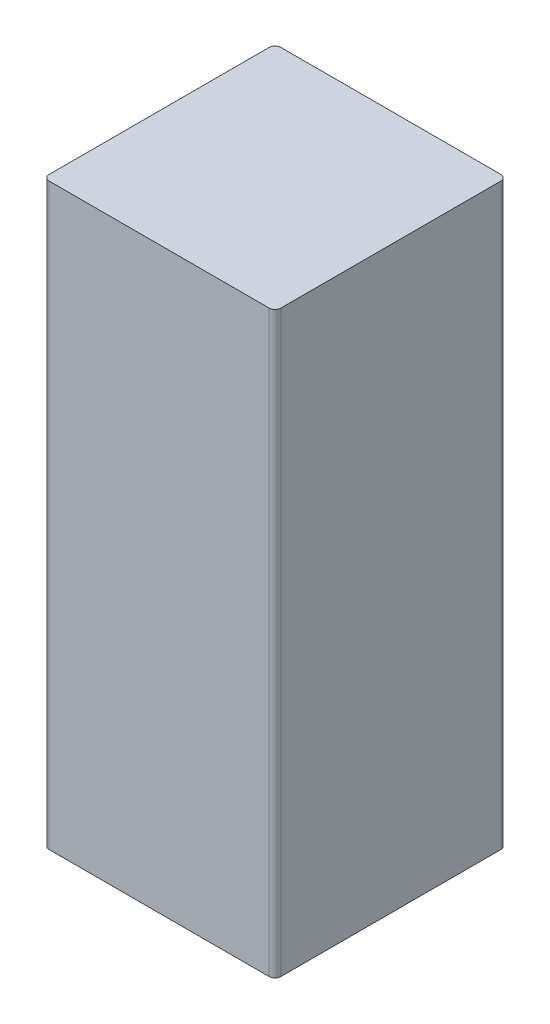
from build123d import *

# Parameters (mm, degrees)
BOSS_EXTRUDE1_DEPTH = 10


with BuildPart() as part:
    # Sketch1 → Boss-Extrude1 (new body)
    with BuildSketch(Plane(origin=(0, 0, 0), x_dir=(1, 0, 0), z_dir=(0, 1, 0))):
        with BuildLine():
            Line((-1.9, -2), (1.9, -2))
            ThreePointArc((1.9, -2), (1.970710678, -1.970710678), (2, -1.9))
            Line((2, -1.9), (2, 1.9))
            ThreePointArc((2, 1.9), (1.970710678, 1.970710678), (1.9, 2))
            Line((1.9, 2), (-1.9, 2))
            ThreePointArc((-1.9, 2), (-1.970710678, 1.970710678), (-2, 1.9))
            Line((-2, 1.9), (-2, -1.9))
            ThreePointArc((-2, -1.9), (-1.970710678, -1.970710678), (-1.9, -2))
        make_face()
    extrude(amount=BOSS_EXTRUDE1_DEPTH)


solid = part.part
